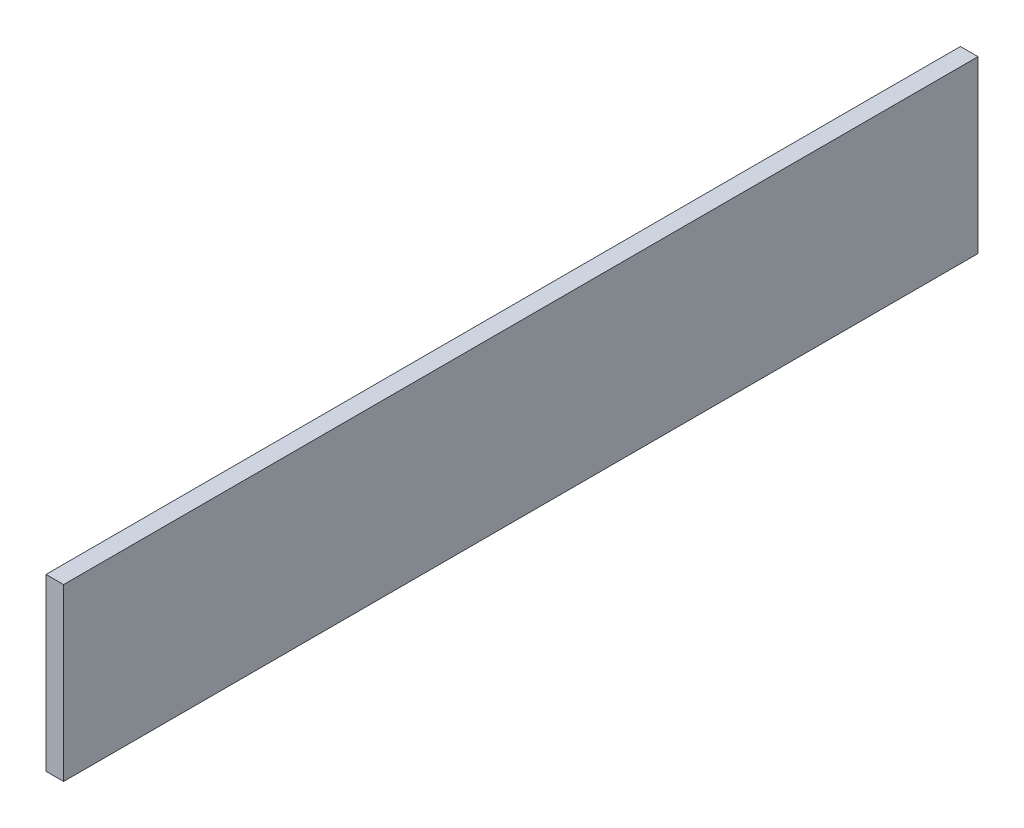
from build123d import *

# Parameters (mm, degrees)
CROQUIS1_W              = 330
CROQUIS1_H              = 61.55
SALIENTE_EXTRUIR2_DEPTH = 6.35


with BuildPart() as part:
    # Croquis1 → Saliente-Extruir2 (new body)
    with BuildSketch(Plane(origin=(0, 0, 0), x_dir=(0, 0, -1), z_dir=(1, 0, 0))):
        Rectangle(CROQUIS1_W, CROQUIS1_H)
    extrude(amount=SALIENTE_EXTRUIR2_DEPTH)


solid = part.part
